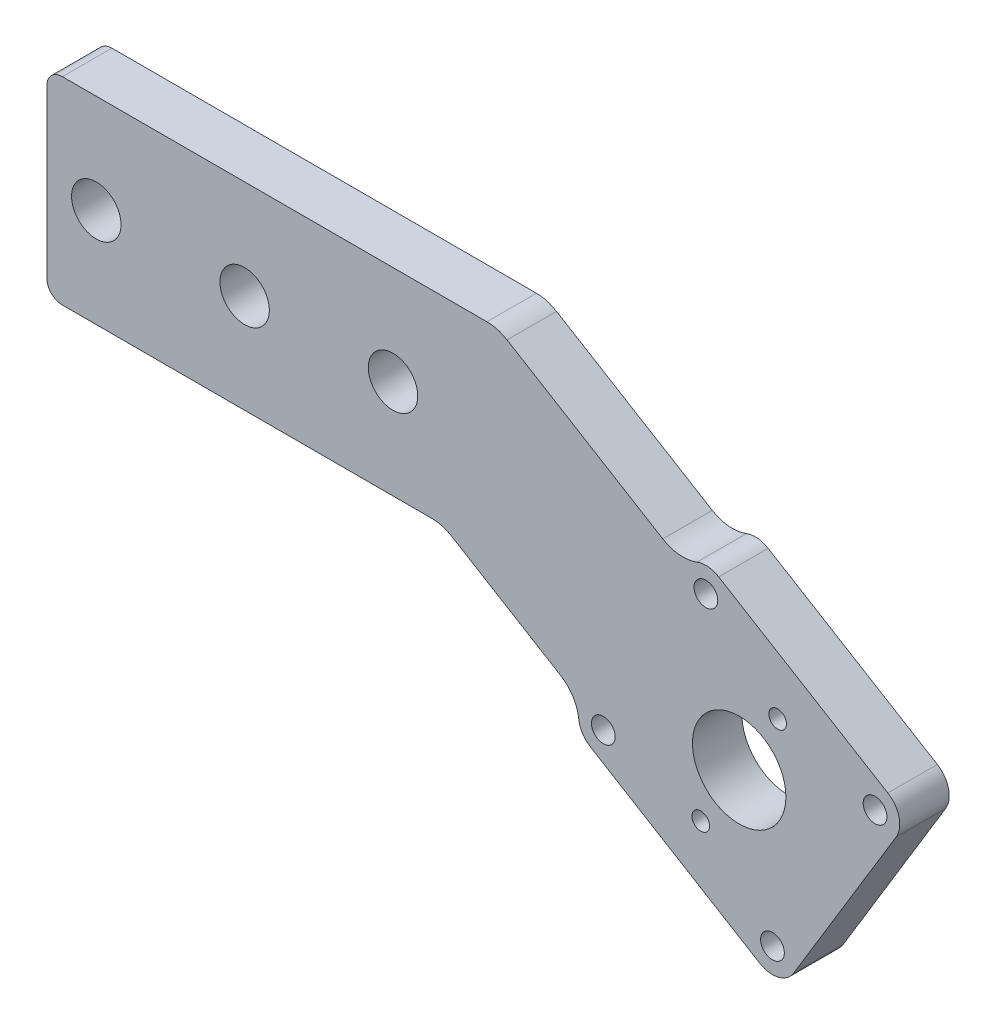
from build123d import *

# Parameters (mm, degrees)
SKETCH1_R           = 6
SKETCH1_R_2         = 1.1303
SKETCH1_R_3         = 3.175
SKETCH1_R_4         = 1.524
BOSS_EXTRUDE1_DEPTH = 6.35
FILLET1_R           = 5


with BuildPart() as part:
    # Sketch1 → Boss-Extrude1 (new body)
    with BuildSketch(Plane.XY):
        with BuildLine():
            Line((-50.8, 10.7), (-50.8, -10.7))
            ThreePointArc((-50.8, -10.7), (-50.214213562, -12.114213562), (-48.8, -12.7))
            Line((-48.8, -12.7), (0, -12.7))
            Line((0, -12.7), (17.940725429, -23.578549747))
            ThreePointArc((17.940725429, -23.578549747), (17.571857186, -25.980430432), (19.009414234, -27.939645668))
            Line((19.009414234, -27.939645668), (40.728550204, -41.109274848))
            ThreePointArc((40.728550204, -41.109274848), (43.130430599, -41.478142773), (45.089645569, -40.040585929))
            Line((45.089645569, -40.040585929), (58.259274749, -18.321449959))
            ThreePointArc((58.259274749, -18.321449959), (58.628143126, -15.91957084), (57.1905883, -13.960355869))
            Line((57.1905883, -13.960355869), (35.47145233, -0.790726689))
            ThreePointArc((35.47145233, -0.790726689), (33.069571007, -0.421856833), (31.110354609, -1.859413778))
            Line((31.110354609, -1.859413778), (7.099208724, 12.7))
            Line((7.099208724, 12.7), (-48.8, 12.7))
            ThreePointArc((-48.8, 12.7), (-50.214213562, 12.114213562), (-50.8, 10.7))
        make_face()
        with Locations((38.1, -20.95)):
            Circle(SKETCH1_R, mode=Mode.SUBTRACT)
        with Locations((43.038610942, -12.805324011)):
            Circle(SKETCH1_R_2, mode=Mode.SUBTRACT)
        with Locations((33.161389058, -29.094675989)):
            Circle(SKETCH1_R_2, mode=Mode.SUBTRACT)
        with Locations((-6.35, 0)):
            Circle(SKETCH1_R_3, mode=Mode.SUBTRACT)
        with Locations((-25.4, 0)):
            Circle(SKETCH1_R_3, mode=Mode.SUBTRACT)
        with Locations((-44.45, 0)):
            Circle(SKETCH1_R_3, mode=Mode.SUBTRACT)
        with Locations((33.825246605, -3.505617425)):
            Circle(SKETCH1_R_4, mode=Mode.SUBTRACT)
        with Locations((20.655617425, -25.224753395)):
            Circle(SKETCH1_R_4, mode=Mode.SUBTRACT)
        with Locations((42.374753395, -38.394382575)):
            Circle(SKETCH1_R_4, mode=Mode.SUBTRACT)
        with Locations((55.544382575, -16.675246605)):
            Circle(SKETCH1_R_4, mode=Mode.SUBTRACT)
    extrude(amount=BOSS_EXTRUDE1_DEPTH)

    # Fillet1
    fillet1_edges = [part.edges().sort_by_distance(p)[0] for p in [
        (17.940725429, -23.578549747, 3.175),
        (0, -12.7, 3.175),
        (7.099208724, 12.7, 3.175),
        (31.110354609, -1.859413778, 3.175),
    ]]
    fillet(fillet1_edges, radius=FILLET1_R)


solid = part.part
